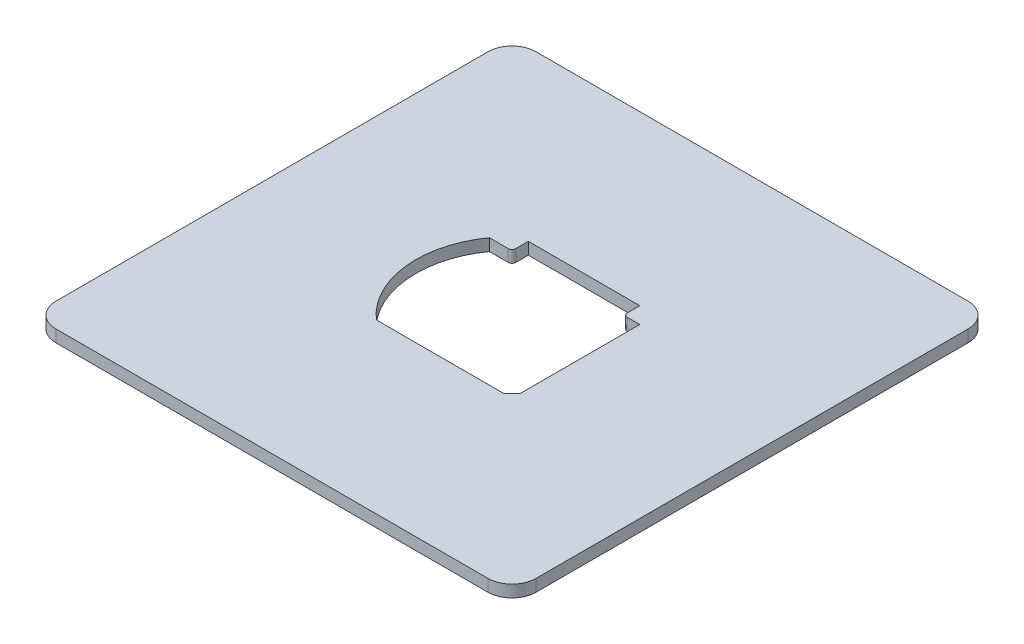
from build123d import *

# Parameters (mm, degrees)
SKETCH1_W           = 63.5
SKETCH1_H           = 63.5
BOSS_EXTRUDE1_DEPTH = 1.5875
FILLET1_R           = 0.508
FILLET2_R           = 3.175


with BuildPart() as part:
    # Sketch1 → Boss-Extrude1 (new body)
    with BuildSketch(Plane(origin=(0, 0, 0), x_dir=(1, 0, 0), z_dir=(0, 1, 0))):
        with Locations((31.75, 31.75)):
            Rectangle(SKETCH1_W, SKETCH1_H)
        with BuildLine():
            Line((24.384, 41.275), (24.384, 39.116))
            Line((24.384, 39.116), (21.388784565, 39.116))
            ThreePointArc((21.388784565, 39.116), (19.120478769, 30.298127151), (23.330551307, 22.225))
            Line((23.330551307, 22.225), (40.169448693, 22.225))
            ThreePointArc((40.169448693, 22.225), (40.739236377, 22.760763623), (41.275, 23.330551307))
            Line((41.275, 23.330551307), (41.275, 39.116))
            Line((41.275, 39.116), (39.116, 39.116))
            Line((39.116, 39.116), (39.116, 41.275))
            Line((39.116, 41.275), (24.384, 41.275))
        make_face(mode=Mode.SUBTRACT)
    extrude(amount=BOSS_EXTRUDE1_DEPTH)

    # Fillet1
    fillet1_edges = [part.edges().sort_by_distance(p)[0] for p in [
        (39.116, 0.79375, -39.116),
        (24.384, 0.79375, -39.116),
    ]]
    fillet(fillet1_edges, radius=FILLET1_R)

    # Fillet2
    fillet2_edges = [part.edges().sort_by_distance(p)[0] for p in [
        (0, 0.79375, -63.5),
        (63.5, 0.79375, -63.5),
        (63.5, 0.79375, 0),
        (0, 0.79375, 0),
    ]]
    fillet(fillet2_edges, radius=FILLET2_R)


solid = part.part
